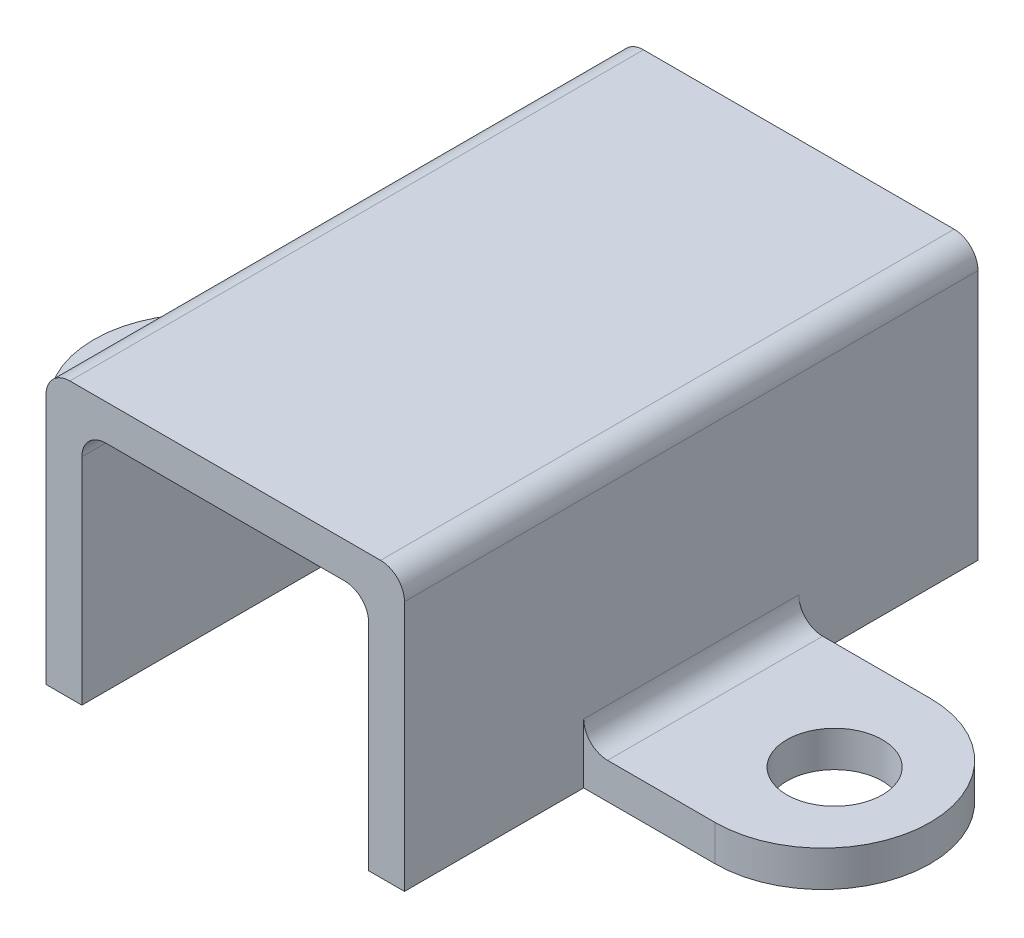
from build123d import *

# Parameters (mm, degrees)
SALIENTE_EXTRUIR2_DEPTH = 12
CROQUIS4_W              = 10
CROQUIS4_H              = 7.5
CORTAR_EXTRUIR2_DEPTH   = 24.457408211
CROQUIS6_R              = 2
CORTAR_EXTRUIR3_DEPTH   = 24.457408211
CORTAR_EXTRUIR4_DEPTH   = 24.457408211
REDONDEO1_R             = 1
REDONDEO2_R             = 1
REDONDEO3_R             = 1
REDONDEO4_R             = 1
REDONDEO5_R             = 1
REDONDEO6_R             = 1


with BuildPart() as part:
    # Croquis1 → Saliente-Extruir2 (new, symmetric)
    with BuildSketch(Plane.XY):
        Polygon((-17.5, -11.5), (-17.5, -10), (-7.5, -10), (-7.5, 0), (7.5, 0), (7.5, -10), (17.5, -10), (17.5, -11.5), (6, -11.5), (6, -1.5), (-6, -1.5), (-6, -11.5), align=None)
    extrude(amount=SALIENTE_EXTRUIR2_DEPTH, both=True)

    # Croquis4 → Cortar-Extruir2 (cut, through all)
    with BuildSketch(Plane(origin=(0, -10, 0), x_dir=(1, 0, 0), z_dir=(0, 1, 0))):
        with Locations((-12.5, 8.25)):
            Rectangle(CROQUIS4_W, CROQUIS4_H)
        with Locations((12.5, 8.25)):
            Rectangle(CROQUIS4_W, CROQUIS4_H)
        with Locations((12.5, -8.25)):
            Rectangle(CROQUIS4_W, CROQUIS4_H)
        with Locations((-12.5, -8.25)):
            Rectangle(CROQUIS4_W, CROQUIS4_H)
    extrude(amount=-CORTAR_EXTRUIR2_DEPTH, mode=Mode.SUBTRACT)

    # Croquis6 → Cortar-Extruir3 (cut, through all)
    with BuildSketch(Plane(origin=(0, -10, 0), x_dir=(1, 0, 0), z_dir=(0, 1, 0))):
        with Locations(Location((-13.5, 0, 0), (0, 0, 270))):
            Circle(CROQUIS6_R)
        with Locations(Location((13.5, 0, 0), (0, 0, 270))):
            Circle(CROQUIS6_R)
    extrude(amount=-CORTAR_EXTRUIR3_DEPTH, mode=Mode.SUBTRACT)

    # Croquis7 → Cortar-Extruir4 (cut, through all)
    with BuildSketch(Plane(origin=(0, -10, 0), x_dir=(1, 0, 0), z_dir=(0, 1, 0))):
        with BuildLine():
            ThreePointArc((-17.5, 0), (-16.181980515, 3.181980515), (-13, 4.5))
            Line((-13, 4.5), (-17.5, 4.5))
            Line((-17.5, 4.5), (-17.5, 0))
        make_face()
        with BuildLine():
            ThreePointArc((-13, -4.5), (-16.181980515, -3.181980515), (-17.5, 0))
            Line((-17.5, 0), (-17.5, -4.5))
            Line((-17.5, -4.5), (-13, -4.5))
        make_face()
        with BuildLine():
            Line((17.5, 4.5), (13, 4.5))
            ThreePointArc((13, 4.5), (16.181980515, 3.181980515), (17.5, 0))
            Line((17.5, 0), (17.5, 4.5))
        make_face()
        with BuildLine():
            Line((17.5, -4.5), (17.5, 0))
            ThreePointArc((17.5, 0), (16.181980515, -3.181980515), (13, -4.5))
            Line((13, -4.5), (17.5, -4.5))
        make_face()
    extrude(amount=-CORTAR_EXTRUIR4_DEPTH, mode=Mode.SUBTRACT)

    # Redondeo1
    redondeo1_edges = [part.edges().sort_by_distance(p)[0] for p in [
        (-7.5, -10, 0),
    ]]
    fillet(redondeo1_edges, radius=REDONDEO1_R)

    # Redondeo2
    redondeo2_edges = [part.edges().sort_by_distance(p)[0] for p in [
        (7.5, -10, 0),
    ]]
    fillet(redondeo2_edges, radius=REDONDEO2_R)

    # Redondeo3
    redondeo3_edges = [part.edges().sort_by_distance(p)[0] for p in [
        (-6, -1.5, 0),
    ]]
    fillet(redondeo3_edges, radius=REDONDEO3_R)

    # Redondeo4
    redondeo4_edges = [part.edges().sort_by_distance(p)[0] for p in [
        (6, -1.5, 0),
    ]]
    fillet(redondeo4_edges, radius=REDONDEO4_R)

    # Redondeo5
    redondeo5_edges = [part.edges().sort_by_distance(p)[0] for p in [
        (-7.5, 0, 0),
    ]]
    fillet(redondeo5_edges, radius=REDONDEO5_R)

    # Redondeo6
    redondeo6_edges = [part.edges().sort_by_distance(p)[0] for p in [
        (7.5, 0, 0),
    ]]
    fillet(redondeo6_edges, radius=REDONDEO6_R)


solid = part.part
